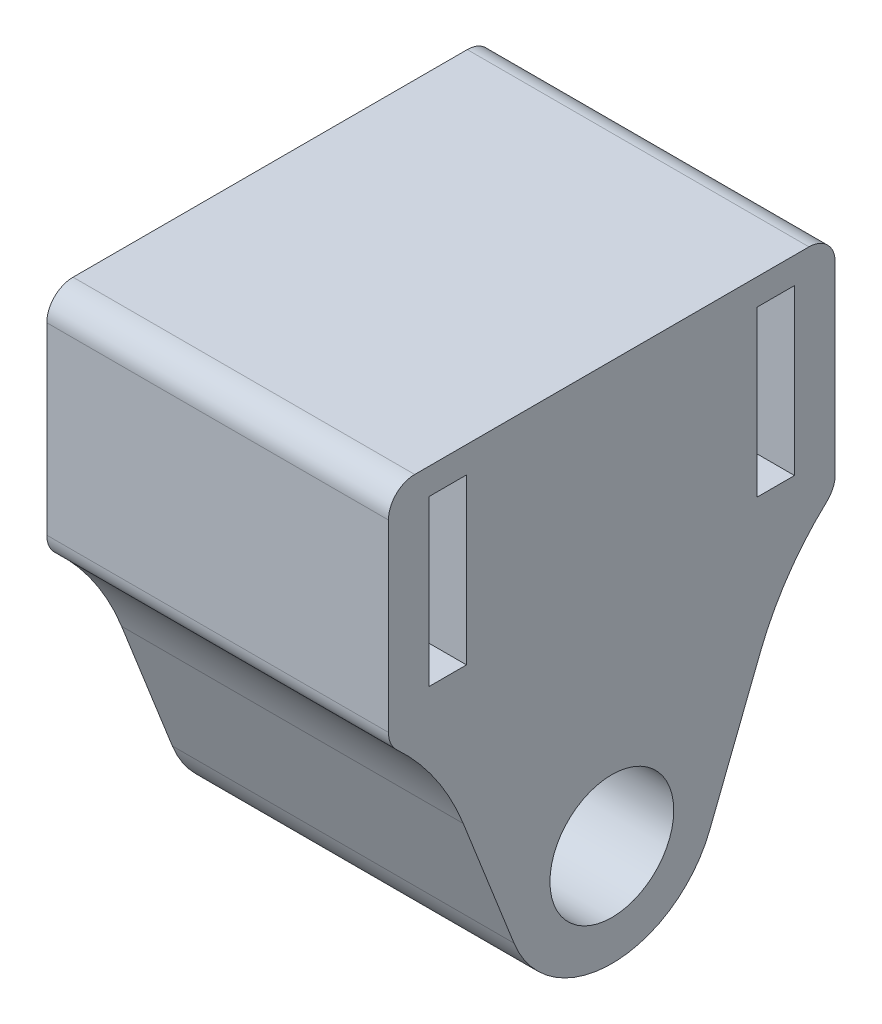
from build123d import *

# Parameters (mm, degrees)
BOSS_EXTRUDE1_DEPTH = 13
FILLET1_R           = 1
FILLET2_R           = 10
SKETCH4_R           = 2.355
SKETCH4_W           = 1.42
SKETCH4_H           = 6.26
CUT_EXTRUDE1_DEPTH  = 18


with BuildPart() as part:
    # Sketch1 → Boss-Extrude1 (new body)
    with BuildSketch(Plane(origin=(0, 0, 0), x_dir=(0, 0, -1), z_dir=(1, 0, 0))):
        with BuildLine():
            Line((-8.5, 7.935), (8.5, 7.935))
            Line((8.5, 7.935), (8.5, -1.065))
            Line((8.5, -1.065), (7, -1.065))
            Line((7, -1.065), (3.722478373, -9.398951763))
            ThreePointArc((3.722478373, -9.398951763), (0, -11.935), (-3.722478373, -9.398951763))
            Line((-3.722478373, -9.398951763), (-7, -1.065))
            Line((-7, -1.065), (-8.5, -1.065))
            Line((-8.5, -1.065), (-8.5, 7.935))
        make_face()
    extrude(amount=-BOSS_EXTRUDE1_DEPTH)

    # Fillet1
    fillet1_edges = [part.edges().sort_by_distance(p)[0] for p in [
        (-6.5, 7.935, 8.5),
        (-6.5, 7.935, -8.5),
        (-6.5, -1.065, -8.5),
        (-6.5, -1.065, 8.5),
    ]]
    fillet(fillet1_edges, radius=FILLET1_R)

    # Fillet2
    fillet2_edges = [part.edges().sort_by_distance(p)[0] for p in [
        (-6.5, -1.065, -7),
        (-6.5, -1.065, 7),
    ]]
    fillet(fillet2_edges, radius=FILLET2_R)

    # Sketch4 → Cut-Extrude1 (cut)
    with BuildSketch(Plane.ZY.offset(13)):
        with Locations((0, -8.06)):
            Circle(SKETCH4_R)
        with Locations((6.24, 3.805)):
            Rectangle(SKETCH4_W, SKETCH4_H)
        with Locations((-6.24, 3.805)):
            Rectangle(SKETCH4_W, SKETCH4_H)
    extrude(amount=-CUT_EXTRUDE1_DEPTH, mode=Mode.SUBTRACT)


solid = part.part
